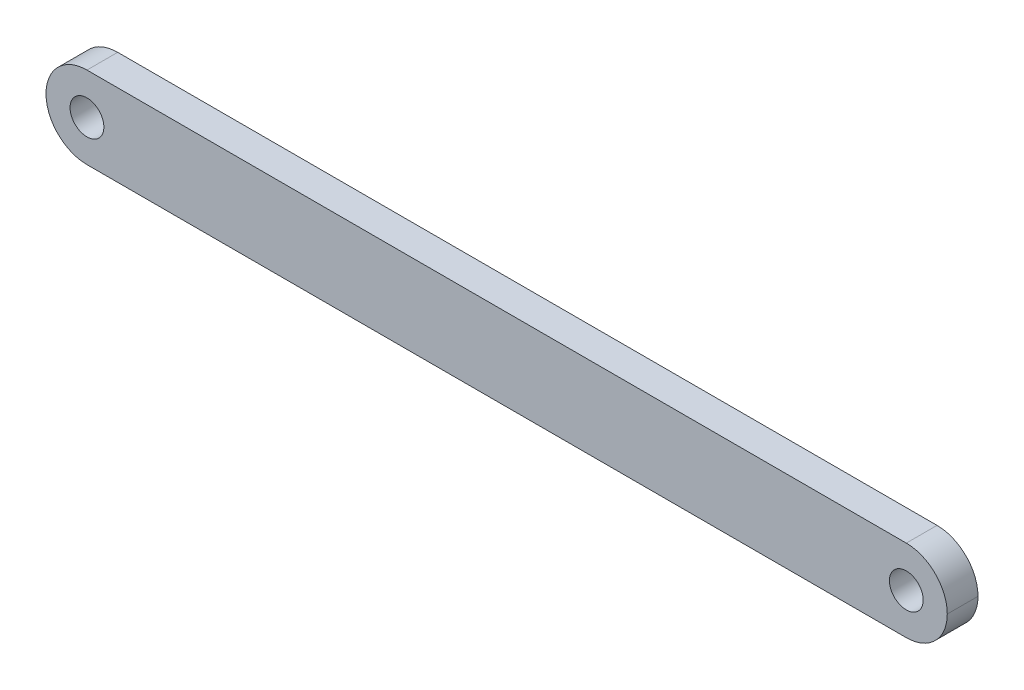
from build123d import *

# Parameters (mm, degrees)
SKETCH_1_R          = 1.65
EXTRUDE_1_DEPTH     = 3
CUT_EXTRUDE_1_DEPTH = 1


with BuildPart() as part:
    # 草图1 → 凸台-拉伸1 (new body)
    with BuildSketch(Plane(origin=(0, 0, 0), x_dir=(-1, 0, 0), z_dir=(0, 0, -1))):
        with BuildLine():
            Line((-55.860221974, 0), (24.13832066, 0))
            ThreePointArc((24.13832066, 0), (26.966394209, 1.171219344), (28.138320535, 3.999))
            ThreePointArc((28.138320535, 3.999), (26.96674766, 6.827427125), (24.138320535, 7.999))
            Line((24.138320535, 7.999), (-55.860222099, 7.999))
            ThreePointArc((-55.860222099, 7.999), (-58.688295648, 6.827780656), (-59.860221974, 4))
            ThreePointArc((-59.860221974, 4), (-58.688649099, 1.171572875), (-55.860221974, 0))
        make_face()
        with Locations((24.138809001, 3.998511534)):
            Circle(SKETCH_1_R, mode=Mode.SUBTRACT)
        with Locations((-55.859733508, 3.999511534)):
            Circle(SKETCH_1_R, mode=Mode.SUBTRACT)
    extrude(amount=-EXTRUDE_1_DEPTH)

    # 草图2 → 切除-拉伸1 (cut)
    with BuildSketch(Plane(origin=(0, 0, 0), x_dir=(-1, 0, 0), z_dir=(0, 0, -1))):
        Polygon((-15.675290893, 5.246411073), (-13.52144474, 5.246411073), (-15.361188329, 1.656667483), (-15.632522464, 1.806006425), (-14.05289506, 4.887436714), (-15.675290893, 4.887436714), align=None)
    extrude(amount=-CUT_EXTRUDE_1_DEPTH, mode=Mode.SUBTRACT)


solid = part.part
